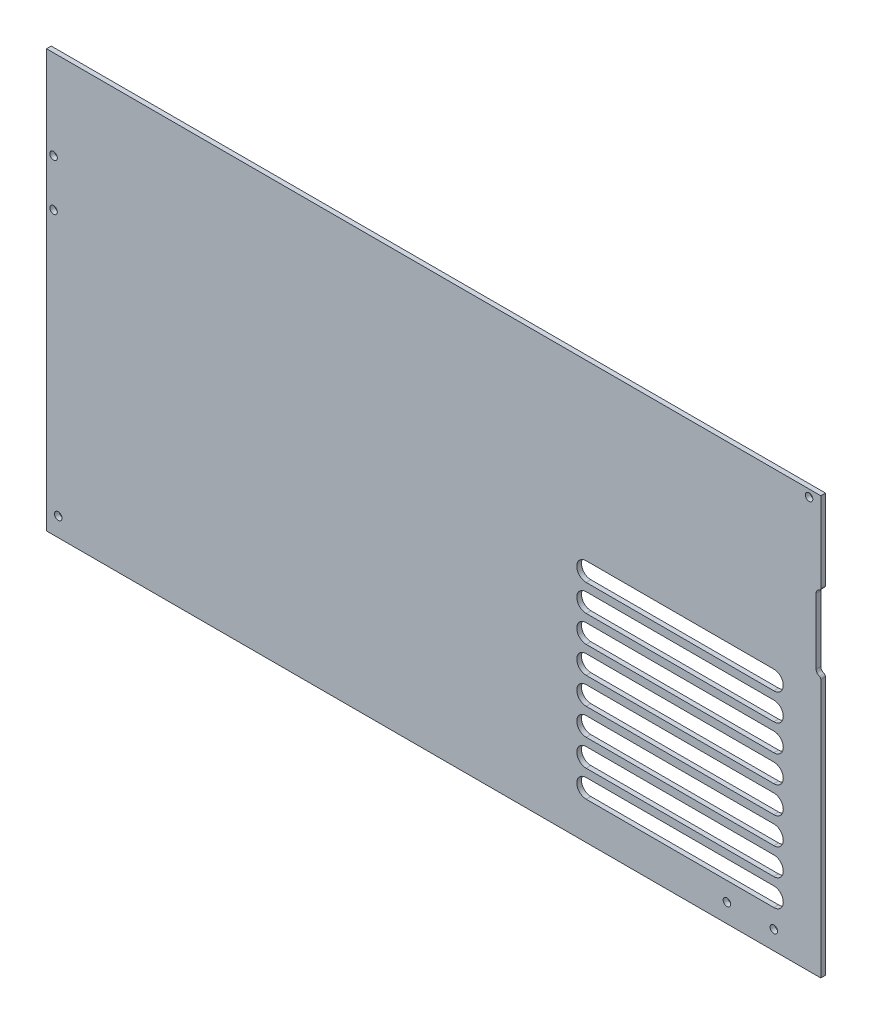
from build123d import *

# Parameters (mm, degrees)
SKETCH_1_W          = 330
SKETCH_1_H          = 178
EXTRUDE_1_DEPTH     = 2
CUT_EXTRUDE_1_REACH = 189.483
CUT_EXTRUDE_2_REACH = 189.483
SKETCH_3_R          = 1.6
CUT_EXTRUDE_4_DEPTH = 188.483332593
FILLET_1_R          = 1


with BuildPart() as part:
    # 草图1 → 凸台-拉伸1 (new body)
    with BuildSketch(Plane.XY):
        Rectangle(SKETCH_1_W, SKETCH_1_H)
    extrude(amount=EXTRUDE_1_DEPTH)

    # 草图2 → 切除-拉伸1 (cut, up to next)
    with BuildSketch(Plane.XY.offset(2), mode=Mode.PRIVATE) as cut_extrude_1_sk1:
        with BuildLine():
            Line((65, 15), (145, 15))
            ThreePointArc((145, 15), (149, 11), (145, 7))
            Line((145, 7), (65, 7))
            ThreePointArc((65, 7), (61, 11), (65, 15))
        make_face()
    cut_extrude_1_tool1 = extrude(cut_extrude_1_sk1.sketch, amount=-CUT_EXTRUDE_1_REACH, mode=Mode.PRIVATE) & part.part
    # 草图2 → 切除-拉伸1 (cut, up to next)
    with BuildSketch(Plane.XY.offset(2), mode=Mode.PRIVATE) as cut_extrude_1_sk2:
        with BuildLine():
            Line((65, -4.428571429), (145, -4.428571429))
            ThreePointArc((145, -4.428571429), (149, -0.428571429), (145, 3.571428571))
            Line((145, 3.571428571), (65, 3.571428571))
            ThreePointArc((65, 3.571428571), (61, -0.428571429), (65, -4.428571429))
        make_face()
    cut_extrude_1_tool2 = extrude(cut_extrude_1_sk2.sketch, amount=-CUT_EXTRUDE_1_REACH, mode=Mode.PRIVATE) & part.part
    # 草图2 → 切除-拉伸1 (cut, up to next)
    with BuildSketch(Plane.XY.offset(2), mode=Mode.PRIVATE) as cut_extrude_1_sk3:
        with BuildLine():
            Line((65, -15.857142857), (145, -15.857142857))
            ThreePointArc((145, -15.857142857), (149, -11.857142857), (145, -7.857142857))
            Line((145, -7.857142857), (65, -7.857142857))
            ThreePointArc((65, -7.857142857), (61, -11.857142857), (65, -15.857142857))
        make_face()
    cut_extrude_1_tool3 = extrude(cut_extrude_1_sk3.sketch, amount=-CUT_EXTRUDE_1_REACH, mode=Mode.PRIVATE) & part.part
    # 草图2 → 切除-拉伸1 (cut, up to next)
    with BuildSketch(Plane.XY.offset(2), mode=Mode.PRIVATE) as cut_extrude_1_sk4:
        with BuildLine():
            Line((65, -27.285714286), (145, -27.285714286))
            ThreePointArc((145, -27.285714286), (149, -23.285714286), (145, -19.285714286))
            Line((145, -19.285714286), (65, -19.285714286))
            ThreePointArc((65, -19.285714286), (61, -23.285714286), (65, -27.285714286))
        make_face()
    cut_extrude_1_tool4 = extrude(cut_extrude_1_sk4.sketch, amount=-CUT_EXTRUDE_1_REACH, mode=Mode.PRIVATE) & part.part
    # 草图2 → 切除-拉伸1 (cut, up to next)
    with BuildSketch(Plane.XY.offset(2), mode=Mode.PRIVATE) as cut_extrude_1_sk5:
        with BuildLine():
            Line((65, -38.714285714), (145, -38.714285714))
            ThreePointArc((145, -38.714285714), (149, -34.714285714), (145, -30.714285714))
            Line((145, -30.714285714), (65, -30.714285714))
            ThreePointArc((65, -30.714285714), (61, -34.714285714), (65, -38.714285714))
        make_face()
    cut_extrude_1_tool5 = extrude(cut_extrude_1_sk5.sketch, amount=-CUT_EXTRUDE_1_REACH, mode=Mode.PRIVATE) & part.part
    # 草图2 → 切除-拉伸1 (cut, up to next)
    with BuildSketch(Plane.XY.offset(2), mode=Mode.PRIVATE) as cut_extrude_1_sk6:
        with BuildLine():
            Line((65, -50.142857143), (145, -50.142857143))
            ThreePointArc((145, -50.142857143), (149, -46.142857143), (145, -42.142857143))
            Line((145, -42.142857143), (65, -42.142857143))
            ThreePointArc((65, -42.142857143), (61, -46.142857143), (65, -50.142857143))
        make_face()
    cut_extrude_1_tool6 = extrude(cut_extrude_1_sk6.sketch, amount=-CUT_EXTRUDE_1_REACH, mode=Mode.PRIVATE) & part.part
    # 草图2 → 切除-拉伸1 (cut, up to next)
    with BuildSketch(Plane.XY.offset(2), mode=Mode.PRIVATE) as cut_extrude_1_sk7:
        with BuildLine():
            Line((65, -61.571428571), (145, -61.571428571))
            ThreePointArc((145, -61.571428571), (149, -57.571428571), (145, -53.571428571))
            Line((145, -53.571428571), (65, -53.571428571))
            ThreePointArc((65, -53.571428571), (61, -57.571428571), (65, -61.571428571))
        make_face()
    cut_extrude_1_tool7 = extrude(cut_extrude_1_sk7.sketch, amount=-CUT_EXTRUDE_1_REACH, mode=Mode.PRIVATE) & part.part
    # 草图2 → 切除-拉伸1 (cut, up to next)
    with BuildSketch(Plane.XY.offset(2), mode=Mode.PRIVATE) as cut_extrude_1_sk8:
        with BuildLine():
            Line((65, -73), (145, -73))
            ThreePointArc((145, -73), (149, -69), (145, -65))
            Line((145, -65), (65, -65))
            ThreePointArc((65, -65), (61, -69), (65, -73))
        make_face()
    cut_extrude_1_tool8 = extrude(cut_extrude_1_sk8.sketch, amount=-CUT_EXTRUDE_1_REACH, mode=Mode.PRIVATE) & part.part
    add(cut_extrude_1_tool1.solids().sort_by_distance((105, 11, 2))[0], mode=Mode.SUBTRACT)
    add(cut_extrude_1_tool2.solids().sort_by_distance((105, -0.428571, 2))[0], mode=Mode.SUBTRACT)
    add(cut_extrude_1_tool3.solids().sort_by_distance((105, -11.857143, 2))[0], mode=Mode.SUBTRACT)
    add(cut_extrude_1_tool4.solids().sort_by_distance((105, -23.285714, 2))[0], mode=Mode.SUBTRACT)
    add(cut_extrude_1_tool5.solids().sort_by_distance((105, -34.714286, 2))[0], mode=Mode.SUBTRACT)
    add(cut_extrude_1_tool6.solids().sort_by_distance((105, -46.142857, 2))[0], mode=Mode.SUBTRACT)
    add(cut_extrude_1_tool7.solids().sort_by_distance((105, -57.571429, 2))[0], mode=Mode.SUBTRACT)
    add(cut_extrude_1_tool8.solids().sort_by_distance((105, -69, 2))[0], mode=Mode.SUBTRACT)

    # 草图3 → 切除-拉伸2 (cut, up to next)
    with BuildSketch(Plane.XY.offset(2), mode=Mode.PRIVATE) as cut_extrude_2_sk1:
        with Locations((-162, 51)):
            Circle(SKETCH_3_R)
    cut_extrude_2_tool1 = extrude(cut_extrude_2_sk1.sketch, amount=-CUT_EXTRUDE_2_REACH, mode=Mode.PRIVATE) & part.part
    # 草图3 → 切除-拉伸2 (cut, up to next)
    with BuildSketch(Plane.XY.offset(2), mode=Mode.PRIVATE) as cut_extrude_2_sk2:
        with Locations((-162, 31)):
            Circle(SKETCH_3_R)
    cut_extrude_2_tool2 = extrude(cut_extrude_2_sk2.sketch, amount=-CUT_EXTRUDE_2_REACH, mode=Mode.PRIVATE) & part.part
    # 草图3 → 切除-拉伸2 (cut, up to next)
    with BuildSketch(Plane.XY.offset(2), mode=Mode.PRIVATE) as cut_extrude_2_sk3:
        with Locations((-160, -81)):
            Circle(SKETCH_3_R)
    cut_extrude_2_tool3 = extrude(cut_extrude_2_sk3.sketch, amount=-CUT_EXTRUDE_2_REACH, mode=Mode.PRIVATE) & part.part
    # 草图3 → 切除-拉伸2 (cut, up to next)
    with BuildSketch(Plane.XY.offset(2), mode=Mode.PRIVATE) as cut_extrude_2_sk4:
        with Locations((145, -81)):
            Circle(SKETCH_3_R)
    cut_extrude_2_tool4 = extrude(cut_extrude_2_sk4.sketch, amount=-CUT_EXTRUDE_2_REACH, mode=Mode.PRIVATE) & part.part
    # 草图3 → 切除-拉伸2 (cut, up to next)
    with BuildSketch(Plane.XY.offset(2), mode=Mode.PRIVATE) as cut_extrude_2_sk5:
        with Locations((125, -81)):
            Circle(SKETCH_3_R)
    cut_extrude_2_tool5 = extrude(cut_extrude_2_sk5.sketch, amount=-CUT_EXTRUDE_2_REACH, mode=Mode.PRIVATE) & part.part
    # 草图3 → 切除-拉伸2 (cut, up to next)
    with BuildSketch(Plane.XY.offset(2), mode=Mode.PRIVATE) as cut_extrude_2_sk6:
        with Locations((160, 86)):
            Circle(SKETCH_3_R)
    cut_extrude_2_tool6 = extrude(cut_extrude_2_sk6.sketch, amount=-CUT_EXTRUDE_2_REACH, mode=Mode.PRIVATE) & part.part
    add(cut_extrude_2_tool1.solids().sort_by_distance((-162, 51, 2))[0], mode=Mode.SUBTRACT)
    add(cut_extrude_2_tool2.solids().sort_by_distance((-162, 31, 2))[0], mode=Mode.SUBTRACT)
    add(cut_extrude_2_tool3.solids().sort_by_distance((-160, -81, 2))[0], mode=Mode.SUBTRACT)
    add(cut_extrude_2_tool4.solids().sort_by_distance((145, -81, 2))[0], mode=Mode.SUBTRACT)
    add(cut_extrude_2_tool5.solids().sort_by_distance((125, -81, 2))[0], mode=Mode.SUBTRACT)
    add(cut_extrude_2_tool6.solids().sort_by_distance((160, 86, 2))[0], mode=Mode.SUBTRACT)

    # 草图5 → 切除-拉伸4 (cut, through all)
    with BuildSketch(Plane.XY.offset(2)):
        with BuildLine():
            Line((167, 52), (167, 24))
            ThreePointArc((167, 24), (165, 22), (163, 24))
            Line((163, 24), (163, 52))
            ThreePointArc((163, 52), (165, 54), (167, 52))
        make_face()
    extrude(amount=-CUT_EXTRUDE_4_DEPTH, mode=Mode.SUBTRACT)

    # 圆角1
    fillet_1_edges = [part.edges().sort_by_distance(p)[0] for p in [
        (165, 54, 1),
        (165, 22, 1),
    ]]
    fillet(fillet_1_edges, radius=FILLET_1_R)


solid = part.part
